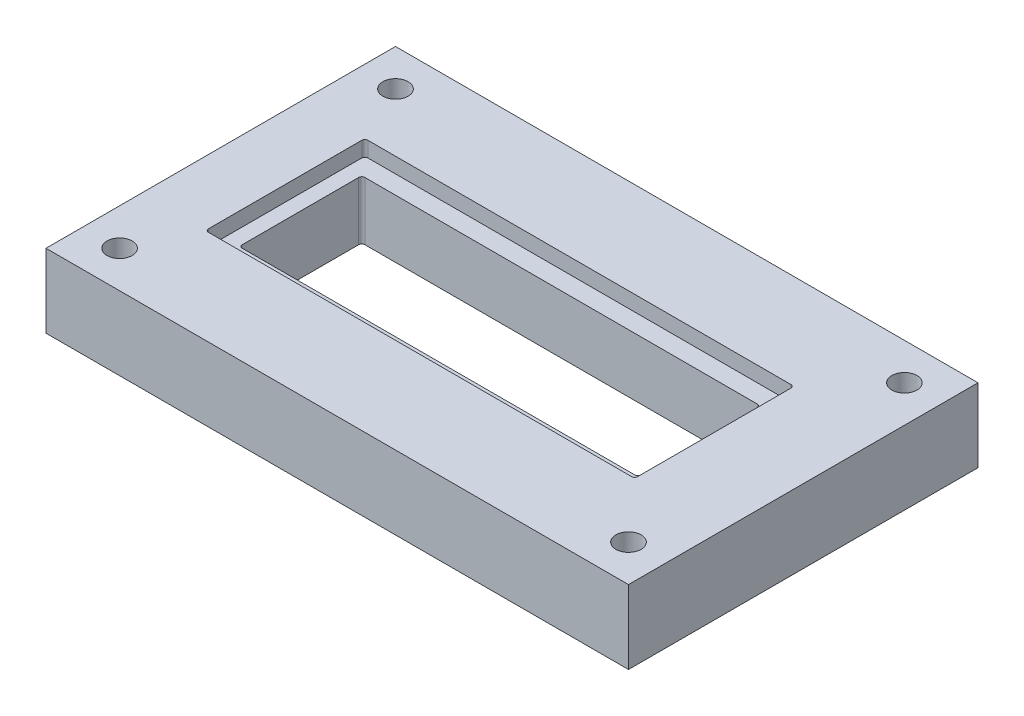
from build123d import *

# Parameters (mm, degrees)
SKETCH1_W           = 95
SKETCH1_H           = 57
SKETCH1_R           = 2.057983022
BOSS_EXTRUDE2_DEPTH = 12
BOSS_EXTRUDE3_DEPTH = 9.5


with BuildPart() as part:
    # Sketch1 → Boss-Extrude2 (new body)
    with BuildSketch(Plane(origin=(0, 0, 0), x_dir=(1, 0, 0), z_dir=(0, 1, 0))):
        Rectangle(SKETCH1_W, SKETCH1_H)
        with Locations((-41.5, -22.5)):
            Circle(SKETCH1_R, mode=Mode.SUBTRACT)
        with Locations((41.5, -22.5)):
            Circle(SKETCH1_R, mode=Mode.SUBTRACT)
        with BuildLine():
            Line((-36.5, 13), (32.5, 13))
            ThreePointArc((32.5, 13), (32.853553391, 12.853553391), (33, 12.5))
            Line((33, 12.5), (33, -12.5))
            ThreePointArc((33, -12.5), (32.853553391, -12.853553391), (32.5, -13))
            Line((32.5, -13), (-36.5, -13))
            ThreePointArc((-36.5, -13), (-36.853553391, -12.853553391), (-37, -12.5))
            Line((-37, -12.5), (-37, 12.5))
            ThreePointArc((-37, 12.5), (-36.853553391, 12.853553391), (-36.5, 13))
        make_face(mode=Mode.SUBTRACT)
        with Locations((-41.5, 22.5)):
            Circle(SKETCH1_R, mode=Mode.SUBTRACT)
        with Locations((41.5, 22.5)):
            Circle(SKETCH1_R, mode=Mode.SUBTRACT)
    extrude(amount=BOSS_EXTRUDE2_DEPTH)

    # Sketch1<5> → Boss-Extrude3 (add)
    with BuildSketch(Plane(origin=(0, 0, 0), x_dir=(1, 0, 0), z_dir=(0, 1, 0))):
        with BuildLine():
            ThreePointArc((33, 12.5), (32.853553391, 12.853553391), (32.5, 13))
            Line((32.5, 13), (-36.5, 13))
            ThreePointArc((-36.5, 13), (-36.853553391, 12.853553391), (-37, 12.5))
            Line((-37, 12.5), (-37, -12.5))
            ThreePointArc((-37, -12.5), (-36.853553391, -12.853553391), (-36.5, -13))
            Line((-36.5, -13), (32.5, -13))
            ThreePointArc((32.5, -13), (32.853553391, -12.853553391), (33, -12.5))
            Line((33, -12.5), (33, 12.5))
        make_face()
        with BuildLine():
            ThreePointArc((30.5, -9.5), (30.353553391, -9.853553391), (30, -10))
            Line((30, -10), (-34, -10))
            ThreePointArc((-34, -10), (-34.353553391, -9.853553391), (-34.5, -9.5))
            Line((-34.5, -9.5), (-34.5, 9.5))
            ThreePointArc((-34.5, 9.5), (-34.353553391, 9.853553391), (-34, 10))
            Line((-34, 10), (30, 10))
            ThreePointArc((30, 10), (30.353553391, 9.853553391), (30.5, 9.5))
            Line((30.5, 9.5), (30.5, -9.5))
        make_face(mode=Mode.SUBTRACT)
    extrude(amount=BOSS_EXTRUDE3_DEPTH)


solid = part.part
